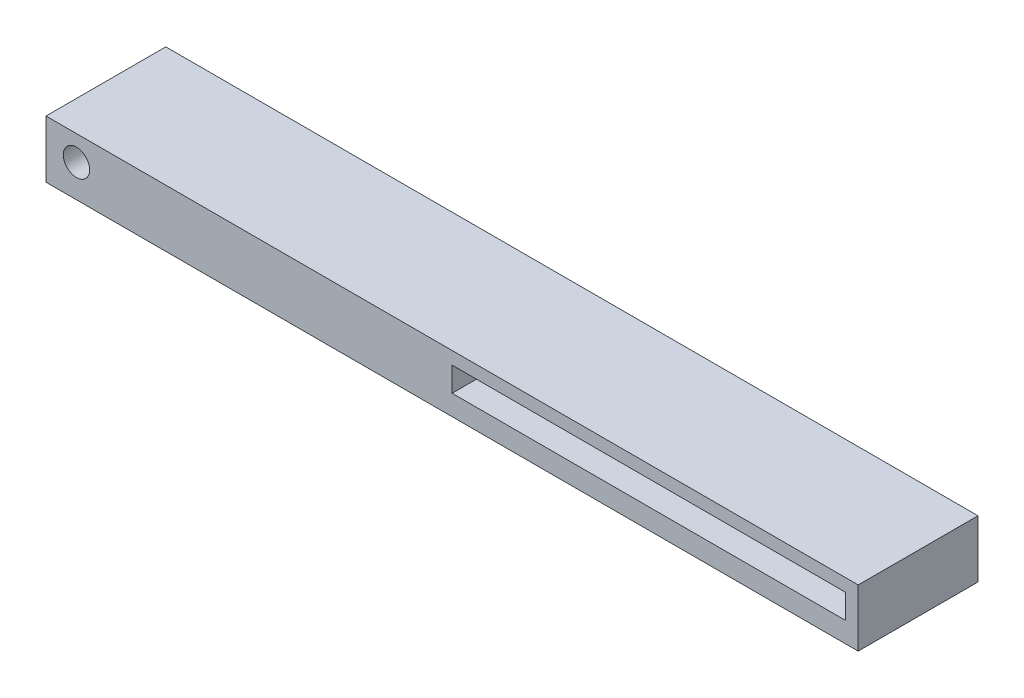
from build123d import *

# Parameters (mm, degrees)
SKETCH1_W                = 101.6
SKETCH1_H                = 25.4
BOSS_EXTRUDE1_DEPTH      = 2.54
BOSS_EXTRUDE2_DEPTH      = 19.05
BOSS_EXTRUDE2_DEPTH_BACK = 2.54
CUT_EXTRUDE1_DEPTH       = 3.81
CUT_EXTRUDE2_DEPTH       = 2.794
SKETCH5_W                = 101.6
SKETCH5_H                = 5.138615385
SKETCH5_H_2              = 5.275384615
CUT_EXTRUDE3_DEPTH       = 3.556
SKETCH6_R                = 1.651
CUT_EXTRUDE4_DEPTH       = 71.061780504


with BuildPart() as part:
    # Sketch1 → Boss-Extrude1 (new body)
    with BuildSketch(Plane(origin=(0, 0, 0), x_dir=(1, 0, 0), z_dir=(0, 1, 0))):
        with Locations((17.263096397, -7.815384615)):
            Rectangle(SKETCH1_W, SKETCH1_H)
    extrude(amount=BOSS_EXTRUDE1_DEPTH)

    # Sketch2 → Boss-Extrude2 (add, two sides: drawn at the far end of the back side and taken through both)
    with BuildSketch(Plane.XY.offset(-BOSS_EXTRUDE2_DEPTH_BACK)):
        Polygon((17.263096397, 2.54), (17.263096397, 5.588), (66.475596397, 5.588), (66.475596397, 2.54), (68.063096397, 2.54), (68.063096397, 7.1755), (-33.536903603, 7.1755), (-33.536903603, 2.54), align=None)
    extrude(amount=BOSS_EXTRUDE2_DEPTH + BOSS_EXTRUDE2_DEPTH_BACK)

    # Sketch3 → Cut-Extrude1 (cut)
    with BuildSketch(Plane.XY.offset(19.05)):
        Polygon((-33.536903603, 7.1755), (-33.536903603, 2.54), (17.263096397, 2.54), (17.263096397, 5.588), (66.475596397, 5.588), (66.475596397, 2.54), (68.063096397, 2.54), (68.063096397, 7.1755), align=None)
    extrude(amount=-CUT_EXTRUDE1_DEPTH, mode=Mode.SUBTRACT)

    # Sketch4 → Cut-Extrude2 (cut)
    with BuildSketch(Plane(origin=(0, 0, -2.54), x_dir=(-1, 0, 0), z_dir=(0, 0, -1))):
        Polygon((-68.063096397, 7.1755), (-68.063096397, 2.54), (-66.475596397, 2.54), (-66.475596397, 5.588), (-17.263096397, 5.588), (-17.263096397, 2.54), (33.536903603, 2.54), (33.536903603, 7.1755), align=None)
    extrude(amount=-CUT_EXTRUDE2_DEPTH, mode=Mode.SUBTRACT)

    # Sketch5 → Cut-Extrude3 (cut)
    with BuildSketch(Plane(origin=(0, 2.54, 0), x_dir=(1, 0, 0), z_dir=(0, 1, 0))):
        with Locations((17.263096397, 2.315307693)):
            Rectangle(SKETCH5_W, SKETCH5_H)
        with Locations((17.263096397, -17.877692308)):
            Rectangle(SKETCH5_W, SKETCH5_H_2)
    extrude(amount=-CUT_EXTRUDE3_DEPTH, mode=Mode.SUBTRACT)

    # Sketch6 → Cut-Extrude4 (cut, through all)
    with BuildSketch(Plane.XY.offset(15.24)):
        with Locations((-29.726903603, 4.064)):
            Circle(SKETCH6_R)
    extrude(amount=-CUT_EXTRUDE4_DEPTH, mode=Mode.SUBTRACT)


solid = part.part
